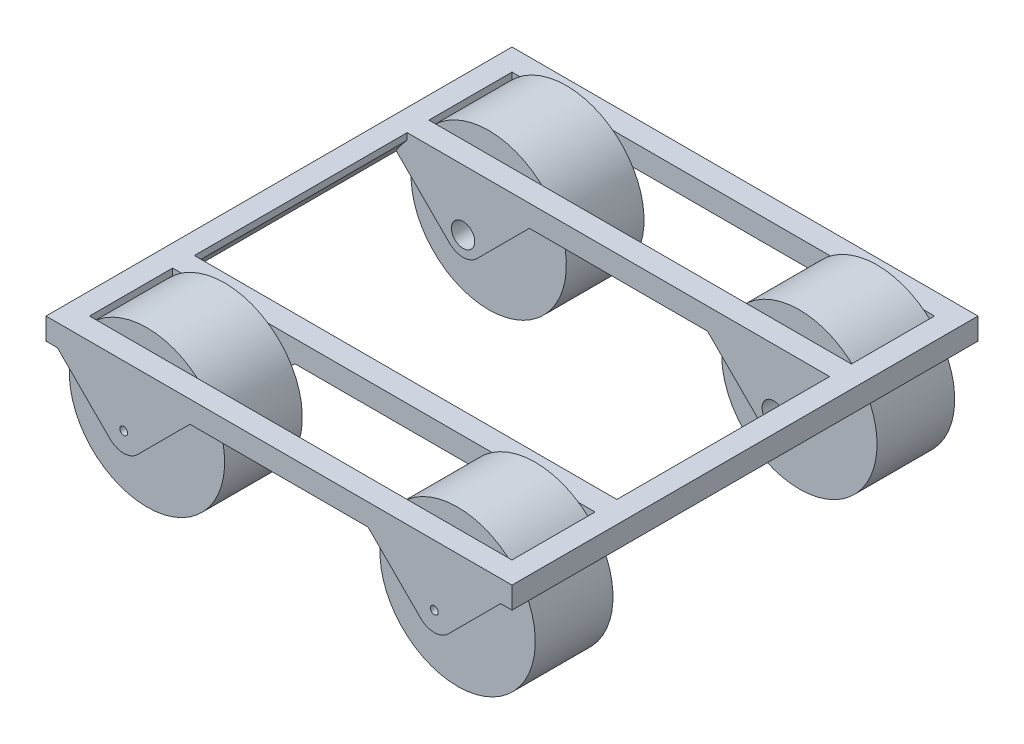
from build123d import *

# Parameters (mm, degrees)
BOSS_EXTRUDE1_START = 300
SKETCH1_R           = 5
BOSS_EXTRUDE1_DEPTH = 28
BOSS_EXTRUDE2_DEPTH = 300
BOSS_EXTRUDE3_START = 270
SKETCH1_5_R         = 100
SKETCH1_5_R_2       = 25
BOSS_EXTRUDE3_DEPTH = 100
BOSS_EXTRUDE4_START = 165
SKETCH1_6_R         = 15
BOSS_EXTRUDE4_DEPTH = 28


with BuildPart() as part:
    # Sketch1 → Boss-Extrude1 (new body)
    with BuildSketch(Plane.XY.offset(BOSS_EXTRUDE1_START)):
        with BuildLine():
            Line((-182.32233047, -67.67766953), (-114.644660941, 0))
            Line((-114.644660941, 0), (0, 0))
            Line((0, 0), (0, 28))
            Line((0, 28), (-300, 28))
            Line((-300, 28), (-300, 0))
            Line((-300, 0), (-285.355339059, 0))
            Line((-285.355339059, 0), (-217.67766953, -67.67766953))
            ThreePointArc((-217.67766953, -67.67766953), (-200, -75), (-182.32233047, -67.67766953))
        make_face()
        with Locations((-200, -50)):
            Circle(SKETCH1_R, mode=Mode.SUBTRACT)
    extrude(amount=-BOSS_EXTRUDE1_DEPTH)

    # Sketch1<4> → Boss-Extrude2 (add)
    with BuildSketch(Plane.XY):
        with BuildLine():
            ThreePointArc((-286.602540378, 0), (-279.89215416, 10.143525867), (-272, 19.397406292))
            Line((-272, 19.397406292), (-272, 28))
            Line((-272, 28), (-300, 28))
            Line((-300, 28), (-300, 0))
            Line((-300, 0), (-286.602540378, 0))
        make_face()
    extrude(amount=BOSS_EXTRUDE2_DEPTH)

    # Sketch1<5> → Boss-Extrude3 (add)
    with BuildSketch(Plane.XY.offset(BOSS_EXTRUDE3_START)):
        with Locations((-200, -50)):
            Circle(SKETCH1_5_R)
        with Locations((-200, -50)):
            Circle(SKETCH1_5_R_2, mode=Mode.SUBTRACT)
    extrude(amount=-BOSS_EXTRUDE3_DEPTH)

    # Sketch1<6> → Boss-Extrude4 (add)
    with BuildSketch(Plane.XY.offset(BOSS_EXTRUDE4_START)):
        with BuildLine():
            Line((-182.32233047, -67.67766953), (-114.644660941, 0))
            Line((-114.644660941, 0), (0, 0))
            Line((0, 0), (0, 28))
            Line((0, 28), (-300, 28))
            Line((-300, 28), (-300, 0))
            Line((-300, 0), (-285.355339059, 0))
            Line((-285.355339059, 0), (-217.67766953, -67.67766953))
            ThreePointArc((-217.67766953, -67.67766953), (-200, -75), (-182.32233047, -67.67766953))
        make_face()
        with Locations((-200, -50)):
            Circle(SKETCH1_6_R, mode=Mode.SUBTRACT)
    extrude(amount=-BOSS_EXTRUDE4_DEPTH)

    # Mirror1: part across plane


with BuildPart() as part_1:
    add(part.part)
    add(part.part.mirror(Plane.XY))

    # Mirror2: part across plane


with BuildPart() as part_2:
    add(part_1.part)
    add(part_1.part.mirror(Plane(origin=(0, 0, 0), x_dir=(0, 0, 1), z_dir=(1, 0, 0))))


solid = part_2.part
